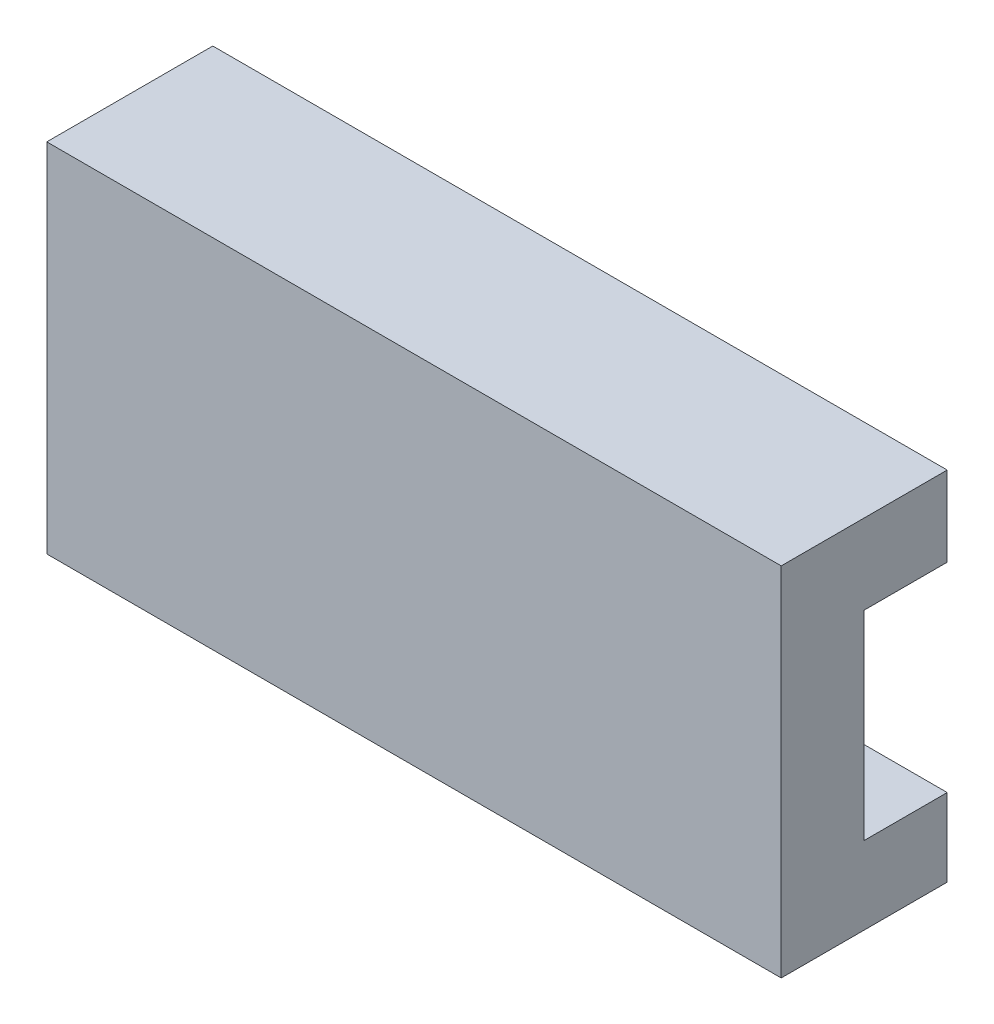
from build123d import *

# Parameters (mm, degrees)
SKETCH1_W           = 44.241636344
SKETCH1_H           = 21.5
BOSS_EXTRUDE1_DEPTH = 10
SKETCH2_W           = 44.241636344
SKETCH2_H           = 12.016013524
CUT_EXTRUDE1_DEPTH  = 5


with BuildPart() as part:
    # Sketch1 → Boss-Extrude1 (new body)
    with BuildSketch(Plane.XY):
        with Locations((0, 2)):
            Rectangle(SKETCH1_W, SKETCH1_H)
    extrude(amount=BOSS_EXTRUDE1_DEPTH)

    # Sketch2 → Cut-Extrude1 (cut)
    with BuildSketch(Plane.XY):
        with Locations((0, 1.933466246)):
            Rectangle(SKETCH2_W, SKETCH2_H)
    extrude(amount=CUT_EXTRUDE1_DEPTH, mode=Mode.SUBTRACT)


solid = part.part
